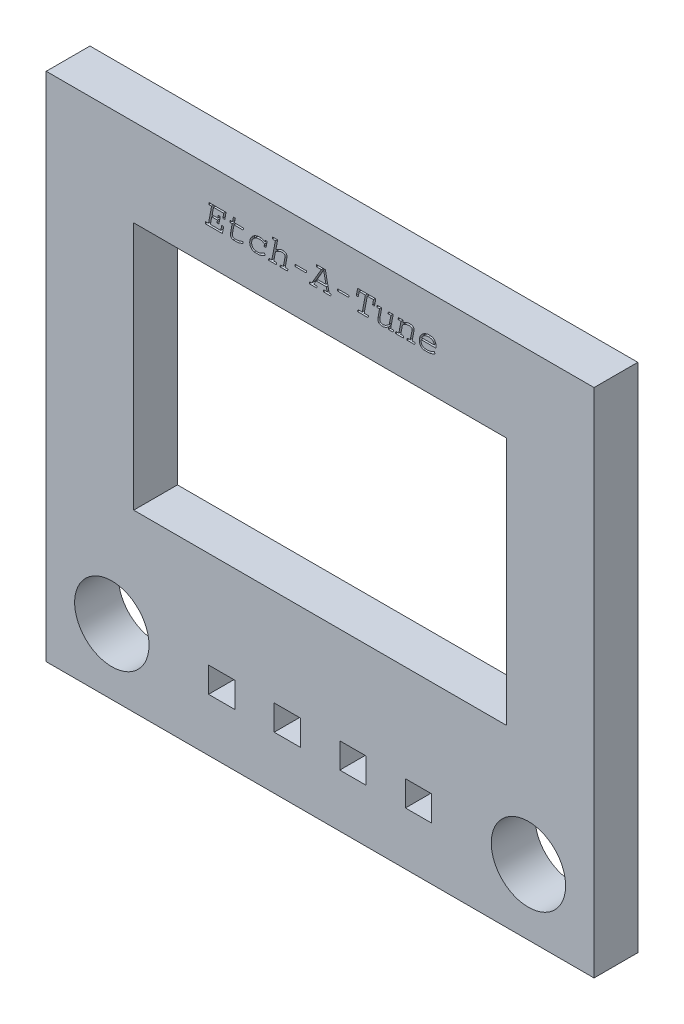
from build123d import *

# Parameters (mm, degrees)
SKETCH1_W               = 125.22
SKETCH1_H               = 116.88
SKETCH1_R               = 8.5
SKETCH1_W_2             = 6
SKETCH1_H_2             = 5.8
SKETCH1_W_3             = 85.22
SKETCH1_H_3             = 56.88
BOSS_EXTRUDE1_DEPTH     = 10
CUT_EXTRUDE2_DEPTH      = 94.295475239
CUT_EXTRUDE2_DEPTH_BACK = 1


with BuildPart() as part:
    # Sketch1 → Boss-Extrude1 (new body)
    with BuildSketch(Plane.XY):
        with Locations((0, -10)):
            Rectangle(SKETCH1_W, SKETCH1_H)
        with Locations((-47.61, -53.44)):
            Circle(SKETCH1_R, mode=Mode.SUBTRACT)
        with Locations((47.61, -53.44)):
            Circle(SKETCH1_R, mode=Mode.SUBTRACT)
        with Locations((-7.5, -53.44)):
            Rectangle(SKETCH1_W_2, SKETCH1_H_2, mode=Mode.SUBTRACT)
        Rectangle(SKETCH1_W_3, SKETCH1_H_3, mode=Mode.SUBTRACT)
        with Locations((-22.5, -53.44)):
            Rectangle(SKETCH1_W_2, SKETCH1_H_2, mode=Mode.SUBTRACT)
        with Locations((7.5, -53.44)):
            Rectangle(SKETCH1_W_2, SKETCH1_H_2, mode=Mode.SUBTRACT)
        with Locations((22.5, -53.44)):
            Rectangle(SKETCH1_W_2, SKETCH1_H_2, mode=Mode.SUBTRACT)
    extrude(amount=BOSS_EXTRUDE1_DEPTH)

    # Sketch3 → Cut-Extrude2 (cut, two sides: drawn at the far end of the back side and taken through both)
    # profile 1 of 12: a face of its own
    with BuildSketch(Plane.XY.offset(10).offset(-CUT_EXTRUDE2_DEPTH_BACK)):
        with BuildLine():
            add(Edge.make_bspline(
                [(-20.482208616, 37.419399751), (-20.497273035, 37.319431814), (-20.504494032, 37.174374239), (-20.484995783, 36.990940881), (-20.454430226, 36.874403035), (-20.409463919, 36.771380531), (-20.347318785, 36.683570606), (-20.271291293, 36.608654394), (-20.149617729, 36.534722886), (-20.027034943, 36.481544268), (-19.935351663, 36.448428045), (-19.910249606, 36.44)],
                knots=[0, 0, 0, 0, 0.171925022, 0.245944784, 0.313097413, 0.376243786, 0.436146033, 0.495162976, 0.556526645, 0.677172165, 0.722203897, 0.722203897, 0.722203897, 0.722203897], degree=3))
            Line((-19.910249606, 36.44), (-18.803897084, 36.44))
            add(Edge.make_bspline(
                [(-18.803897084, 36.44), (-18.783909316, 36.444085664), (-18.68653034, 36.464960845), (-18.288731162, 36.571282582), (-17.919603408, 36.702322853), (-17.629177284, 36.815908555)],
                knots=[0.337511133, 0.337511133, 0.337511133, 0.337511133, 0.370352222, 0.497835334, 1, 1, 1, 1], degree=3))
            Line((-17.629177284, 36.815908555), (-17.628643738, 36.816936886))
            Line((-17.628643738, 36.816936886), (-17.596366458, 37.250710149))
            add(Edge.make_bspline(
                [(-17.596366458, 37.250710149), (-17.720004103, 37.202498545), (-17.91275563, 37.133211815), (-18.178413089, 37.040950942), (-18.391613457, 36.967098556), (-18.610218931, 36.901582527), (-18.898213658, 36.836422924), (-19.115509554, 36.812385655), (-19.258892633, 36.808904048)],
                knots=[0, 0, 0, 0, 0.23027056, 0.355424111, 0.488041894, 0.621808423, 0.751237929, 1, 1, 1, 1], degree=3))
            add(Edge.make_bspline(
                [(-19.258892633, 36.808904048), (-19.364749876, 36.806227976), (-19.579403341, 36.822022979), (-19.779123271, 36.902461941), (-19.872954434, 36.952496446)],
                knots=[0, 0, 0, 0, 0.499017634, 1, 1, 1, 1], degree=3))
            add(Edge.make_bspline(
                [(-19.872954434, 36.952496446), (-19.921350257, 36.98250242), (-19.983118642, 37.044006743), (-20.034170389, 37.147849324), (-20.076913868, 37.328371885), (-20.065145785, 37.488377279), (-20.042230025, 37.612087543)],
                knots=[0, 0, 0, 0, 0.235221558, 0.352052531, 0.475253622, 1, 1, 1, 1], degree=3))
            Line((-20.042230025, 37.612087543), (-19.670181702, 39.507973027))
            Line((-19.670181702, 39.507973027), (-17.588297138, 39.507973027))
            Line((-17.588297138, 39.507973027), (-17.507603937, 39.946922147))
            Line((-17.507603937, 39.946922147), (-19.589488502, 39.946922147))
            Line((-19.589488502, 39.946922147), (-19.387755501, 40.987864429))
            Line((-19.387755501, 40.987864429), (-19.823498782, 40.987864429))
            Line((-19.823498782, 40.987864429), (-20.025231783, 39.946922147))
            Line((-20.025231783, 39.946922147), (-20.561013883, 39.946922147))
            Line((-20.561013883, 39.946922147), (-20.641707083, 39.507973027))
            Line((-20.641707083, 39.507973027), (-20.102768166, 39.507973027))
            Line((-20.102768166, 39.507973027), (-20.482208616, 37.419399751))
        make_face()
    # profile 2 of 12: a face of its own
    with BuildSketch(Plane.XY.offset(10).offset(-CUT_EXTRUDE2_DEPTH_BACK)):
        with BuildLine():
            add(Edge.make_bspline(
                [(-16.059000246, 38.245995448), (-16.08015707, 38.107140519), (-16.102850085, 37.902942111), (-16.087941017, 37.638369219), (-16.060585635, 37.45857299), (-16.014452958, 37.290771138), (-15.947855906, 37.136283744), (-15.865163169, 36.993047418), (-15.761476061, 36.865373205), (-15.644311073, 36.750761535), (-15.516129737, 36.650052175), (-15.376571625, 36.565657085), (-15.22797446, 36.494689453), (-15.117297003, 36.458038592), (-15.057820656, 36.441530507), (-15.052205643, 36.44)],
                knots=[0, 0, 0, 0, 0.149284047, 0.216678658, 0.280614799, 0.341916287, 0.400731881, 0.458649563, 0.516805113, 0.574607918, 0.632251282, 0.689318168, 0.747304962, 0.806575194, 0.812745749, 0.812745749, 0.812745749, 0.812745749], degree=3))
            Line((-15.052205643, 36.44), (-13.874437976, 36.44))
            add(Edge.make_bspline(
                [(-13.874437976, 36.44), (-13.827584008, 36.45014216), (-13.698508279, 36.481461605), (-13.491643304, 36.546276343), (-13.258131208, 36.640227069), (-12.958624307, 36.784351777), (-12.744158728, 36.910551774), (-12.608113017, 37.00503025)],
                knots=[0.320757593, 0.320757593, 0.320757593, 0.320757593, 0.390771073, 0.514663053, 0.637126272, 0.758166563, 1, 1, 1, 1], degree=3))
            Line((-12.608113017, 37.00503025), (-12.607205532, 37.006098483))
            Line((-12.607205532, 37.006098483), (-12.695968052, 37.443452664))
            add(Edge.make_bspline(
                [(-12.695968052, 37.443452664), (-12.779597468, 37.379377425), (-12.927028104, 37.287201756), (-13.14703679, 37.16211058), (-13.352371483, 37.054772738), (-13.576796432, 36.952868786), (-13.895328244, 36.8516346), (-14.143556607, 36.814069916), (-14.310208274, 36.806569212)],
                knots=[0, 0, 0, 0, 0.17937575, 0.296149719, 0.431466096, 0.574347387, 0.715767065, 1, 1, 1, 1], degree=3))
            add(Edge.make_bspline(
                [(-14.310208274, 36.806569212), (-14.450203925, 36.812592541), (-14.651547996, 36.831498148), (-14.901206911, 36.893214846), (-15.059593134, 36.949878354), (-15.197316713, 37.021017945), (-15.315127398, 37.105486498), (-15.411936063, 37.204744426), (-15.484352931, 37.318065333), (-15.539896627, 37.436042866), (-15.58694697, 37.552561333), (-15.623851027, 37.667459897), (-15.64865991, 37.781210242), (-15.661394761, 37.893870493), (-15.664596338, 38.04168789), (-15.65160828, 38.151576513), (-15.634060141, 38.22264709)],
                knots=[0, 0, 0, 0, 0.185136859, 0.265600362, 0.338874002, 0.406636634, 0.469503129, 0.529431379, 0.588401354, 0.646052855, 0.70136492, 0.754151755, 0.805121093, 0.854745412, 0.903544387, 1, 1, 1, 1], degree=3))
            add(Edge.make_bspline(
                [(-15.634060141, 38.22264709), (-15.615201596, 38.312982006), (-15.576152133, 38.446135913), (-15.49916954, 38.613892193), (-15.429889349, 38.734282143), (-15.350122769, 38.850107562), (-15.259966224, 38.962111611), (-15.156598797, 39.067633846), (-15.044199257, 39.169135844), (-14.922280892, 39.262103032), (-14.792553016, 39.344495923), (-14.654723028, 39.412997763), (-14.511166618, 39.4722072), (-14.359655488, 39.517308536), (-14.145479443, 39.563269851), (-13.97919635, 39.578485348), (-13.866589483, 39.581521493)],
                knots=[0, 0, 0, 0, 0.115015297, 0.172080703, 0.229638415, 0.287876346, 0.347172525, 0.408555374, 0.471737072, 0.535745095, 0.599377335, 0.662915281, 0.727296895, 0.792644528, 0.859598727, 1, 1, 1, 1], degree=3))
            add(Edge.make_bspline(
                [(-13.866589483, 39.581521493), (-13.754221209, 39.58495564), (-13.58853153, 39.575534414), (-13.37482953, 39.536714476), (-13.226046458, 39.493036646), (-13.084852934, 39.437236496), (-12.907808311, 39.342702435), (-12.78687426, 39.252637431), (-12.713180625, 39.184599417)],
                knots=[0, 0, 0, 0, 0.269310277, 0.396464342, 0.519857169, 0.640417922, 0.759763624, 1, 1, 1, 1], degree=3))
            Line((-12.713180625, 39.184599417), (-12.817007852, 38.636236793))
            Line((-12.817007852, 38.636236793), (-12.373195251, 38.636236793))
            Line((-12.373195251, 38.636236793), (-12.098838371, 40.021636891))
            Line((-12.098838371, 40.021636891), (-12.542650972, 40.021636891))
            Line((-12.542650972, 40.021636891), (-12.615274852, 39.64539088))
            add(Edge.make_bspline(
                [(-12.615274852, 39.64539088), (-12.694124049, 39.704856369), (-12.818080358, 39.787810372), (-12.997472061, 39.873035079), (-13.138690482, 39.926356696), (-13.287059979, 39.966359728), (-13.496867772, 40.008240182), (-13.65961146, 40.019556006), (-13.769693799, 40.020470613)],
                knots=[0, 0, 0, 0, 0.239879832, 0.360255007, 0.48127662, 0.605673659, 0.732716306, 1, 1, 1, 1], degree=3))
            add(Edge.make_bspline(
                [(-13.769693799, 40.020470613), (-13.934782687, 40.013706007), (-14.17687666, 39.989776205), (-14.484944191, 39.918539822), (-14.695488411, 39.84925883), (-14.891180959, 39.764737411), (-15.071237169, 39.661540199), (-15.238427464, 39.544634713), (-15.386059719, 39.407844252), (-15.519899662, 39.265342594), (-15.640997051, 39.121293324), (-15.747483705, 38.976869288), (-15.838866545, 38.831544881), (-15.916651908, 38.686251863), (-15.999935326, 38.494611767), (-16.041883388, 38.345659219), (-16.059000246, 38.245995448)],
                knots=[0, 0, 0, 0, 0.158335924, 0.232205823, 0.302458624, 0.370394891, 0.436000599, 0.500953953, 0.565343349, 0.628364167, 0.688164326, 0.74549602, 0.800100691, 0.852460794, 0.903216108, 1, 1, 1, 1], degree=3))
        make_face()
    # profile 3 of 12: a face of its own
    with BuildSketch(Plane.XY.offset(10).offset(-CUT_EXTRUDE2_DEPTH_BACK)):
        with BuildLine():
            Line((23.703723188, 36.44), (24.964770159, 36.44))
            add(Edge.make_bspline(
                [(24.964770159, 36.44), (24.987926485, 36.444452529), (25.095518979, 36.466178763), (25.285897379, 36.513556244), (25.531913461, 36.589871886), (25.850708678, 36.701826957), (26.081006708, 36.803855801), (26.229544747, 36.87894912)],
                knots=[0.336902526, 0.336902526, 0.336902526, 0.336902526, 0.371837561, 0.499516502, 0.627371085, 0.75338703, 1, 1, 1, 1], degree=3))
            Line((26.229544747, 36.87894912), (26.229954027, 36.879935269))
            Line((26.229954027, 36.879935269), (26.173468787, 37.307669653))
            add(Edge.make_bspline(
                [(26.173468787, 37.307669653), (26.006773567, 37.224313745), (25.759296002, 37.110289417), (25.426908014, 36.991633308), (25.195826411, 36.922386957), (24.978946988, 36.87254899), (24.730238298, 36.823147141), (24.551669218, 36.80757936), (24.439893149, 36.806569212)],
                knots=[0, 0, 0, 0, 0.307566299, 0.448678463, 0.581915956, 0.705232438, 0.815643938, 1, 1, 1, 1], degree=3))
            add(Edge.make_bspline(
                [(24.439893149, 36.806569212), (24.258804454, 36.807793771), (24.032852833, 36.821445353), (23.773928483, 36.884232664), (23.617855742, 36.942923258), (23.50842515, 37.001303709), (23.441750868, 37.049392129)],
                knots=[0, 0, 0, 0, 0.521686336, 0.645104503, 0.764352816, 1, 1, 1, 1], degree=3))
            add(Edge.make_bspline(
                [(23.441750868, 37.049392129), (23.372997104, 37.098047261), (23.28808178, 37.196182485), (23.200061961, 37.349634496), (23.149008507, 37.483763908), (23.111329883, 37.628522227), (23.086881467, 37.834973851), (23.095039936, 37.992829519), (23.111371611, 38.097733378)],
                knots=[0, 0, 0, 0, 0.217640528, 0.334392378, 0.459650859, 0.590528753, 0.723384468, 1, 1, 1, 1], degree=3))
            Line((23.111371611, 38.097733378), (23.127601455, 38.163107639))
            Line((23.127601455, 38.163107639), (26.431687027, 38.163107639))
            add(Edge.make_bspline(
                [(26.431687027, 38.163107639), (26.456413892, 38.284260522), (26.481226859, 38.464940193), (26.483121048, 38.702330497), (26.469739468, 38.869812812), (26.438734381, 39.029483905), (26.395351609, 39.18274672), (26.332809879, 39.32699013), (26.259617843, 39.465323575), (26.167455706, 39.592810573), (26.05354993, 39.703706532), (25.919841025, 39.797885707), (25.76602395, 39.874720743), (25.593231924, 39.936604704), (25.325531595, 39.998921481), (25.111781053, 40.016207733), (24.964063773, 40.020470613)],
                knots=[0, 0, 0, 0, 0.131929456, 0.193772399, 0.252918713, 0.310794655, 0.36700822, 0.422433297, 0.478148215, 0.533685068, 0.589449434, 0.646913166, 0.707424242, 0.772280091, 0.842245474, 1, 1, 1, 1], degree=3))
            add(Edge.make_bspline(
                [(24.964063773, 40.020470613), (24.830127216, 40.017642061), (24.631023897, 40.002559422), (24.373550115, 39.948132011), (24.187957166, 39.895092574), (24.009536126, 39.824318216), (23.836684562, 39.740138491), (23.670870677, 39.640141603), (23.511347452, 39.527844185), (23.362411499, 39.402191656), (23.225940136, 39.265098701), (23.104696528, 39.116698068), (22.997313611, 38.957806178), (22.905515294, 38.788177667), (22.798859347, 38.545146271), (22.743466452, 38.351164077), (22.71678437, 38.217977419)],
                knots=[0, 0, 0, 0, 0.128681092, 0.190871087, 0.252333425, 0.313715137, 0.374850912, 0.436662917, 0.499358916, 0.561910123, 0.623446181, 0.684755125, 0.745562583, 0.807235637, 0.869619359, 1, 1, 1, 1], degree=3))
            add(Edge.make_bspline(
                [(22.71678437, 38.217977419), (22.692059545, 38.10044191), (22.6696667, 37.924589381), (22.670990795, 37.693030983), (22.686838571, 37.528682717), (22.719738871, 37.370679729), (22.767957448, 37.218938111), (22.831088427, 37.073458306), (22.910254478, 36.934940768), (23.007926752, 36.806825701), (23.127870458, 36.693984712), (23.27020617, 36.599624303), (23.432375611, 36.519605083), (23.580360472, 36.470687748), (23.673054638, 36.447123351), (23.703723188, 36.44)],
                knots=[0, 0, 0, 0, 0.125286762, 0.184149964, 0.241265503, 0.297234199, 0.352182212, 0.407085221, 0.462371085, 0.518233685, 0.574520933, 0.63329308, 0.695745078, 0.762627266, 0.795462314, 0.795462314, 0.795462314, 0.795462314], degree=3))
        make_face()
        with BuildLine():
            add(Edge.make_bspline(
                [(24.875340015, 39.581521493), (24.998048906, 39.576894608), (25.173065078, 39.556331331), (25.391564968, 39.507453716), (25.528576317, 39.460508347), (25.647614726, 39.404345909), (25.747396907, 39.335464668), (25.830244413, 39.257460497), (25.889654204, 39.16698027), (25.9353001, 39.076794683), (25.976218542, 38.99238937), (26.007590565, 38.913138806), (26.03158294, 38.839519874), (26.046410258, 38.771810605), (26.058660535, 38.693307905), (26.053239856, 38.636539852), (26.043925305, 38.602057899)],
                knots=[0, 0, 0, 0, 0.211912772, 0.303701498, 0.386173157, 0.461624967, 0.530234393, 0.594877287, 0.656771187, 0.715998313, 0.769515657, 0.81869113, 0.863117512, 0.903067969, 0.938333711, 1, 1, 1, 1], degree=3))
            Line((26.043925305, 38.602057899), (23.232354408, 38.602057899))
            add(Edge.make_bspline(
                [(23.232354408, 38.602057899), (23.250326071, 38.66445498), (23.292503039, 38.753356352), (23.361826332, 38.867094617), (23.42528178, 38.950317432), (23.496587463, 39.033069548), (23.57917212, 39.112025611), (23.67012191, 39.190260972), (23.769953483, 39.266279068), (23.879226728, 39.335839904), (23.996913207, 39.398359759), (24.123029524, 39.451948175), (24.257789581, 39.496235771), (24.400656594, 39.531230321), (24.606749539, 39.565624409), (24.766406973, 39.578257099), (24.875340015, 39.581521493)],
                knots=[0, 0, 0, 0, 0.095332743, 0.144541112, 0.196185087, 0.249464077, 0.305463924, 0.36446722, 0.426325652, 0.490316448, 0.55525981, 0.622619761, 0.692118577, 0.764210348, 0.839302135, 1, 1, 1, 1], degree=3))
        make_face(mode=Mode.SUBTRACT)
    # profile 4 of 12: a face of its own
    with BuildSketch(Plane.XY.offset(10).offset(-CUT_EXTRUDE2_DEPTH_BACK)):
        with BuildLine():
            add(Edge.make_bspline(
                [(13.410129095, 36.63729362), (13.458240866, 36.588416531), (13.542810978, 36.528386544), (13.659064832, 36.469346829), (13.717273098, 36.448245547), (13.74302901, 36.44)],
                knots=[0, 0, 0, 0, 0.232386943, 0.350881934, 0.442866453, 0.442866453, 0.442866453, 0.442866453], degree=3))
            Line((13.74302901, 36.44), (14.713685987, 36.44))
            add(Edge.make_bspline(
                [(14.713685987, 36.44), (14.745171679, 36.449038026), (14.806915849, 36.468298454), (14.901153678, 36.501888843), (14.997276392, 36.545318731), (15.099273401, 36.598755122), (15.207864232, 36.659912886), (15.320949434, 36.733580044), (15.48751756, 36.845799886), (15.611110904, 36.941290218), (15.695933288, 37.007365086)],
                knots=[0.301705281, 0.301705281, 0.301705281, 0.301705281, 0.361790786, 0.420289256, 0.485171166, 0.555104792, 0.631530698, 0.713725298, 0.802640923, 1, 1, 1, 1], degree=3))
            Line((15.695933288, 37.007365086), (15.591615837, 36.444669671))
            Line((15.591615837, 36.444669671), (16.689043359, 36.444669671))
            Line((16.689043359, 36.444669671), (16.777805879, 36.883618791))
            Line((16.777805879, 36.883618791), (16.116121638, 36.883618791))
            Line((16.116121638, 36.883618791), (16.705181999, 39.946922147))
            Line((16.705181999, 39.946922147), (15.599685157, 39.946922147))
            Line((15.599685157, 39.946922147), (15.518991957, 39.507973027))
            Line((15.518991957, 39.507973027), (16.188745518, 39.507973027))
            Line((16.188745518, 39.507973027), (15.801418157, 37.560566109))
            add(Edge.make_bspline(
                [(15.801418157, 37.560566109), (15.704199716, 37.456848351), (15.545750321, 37.315242642), (15.320354896, 37.145894241), (15.146617302, 37.031275683), (14.967146725, 36.934065911), (14.719686505, 36.842472658), (14.526195436, 36.808397413), (14.396597197, 36.806569212)],
                knots=[0, 0, 0, 0, 0.260632244, 0.389185175, 0.517149541, 0.642384326, 0.76283589, 1, 1, 1, 1], degree=3))
            add(Edge.make_bspline(
                [(14.396597197, 36.806569212), (14.28853953, 36.806246478), (14.080333832, 36.828912813), (13.88662861, 36.912016864), (13.808218589, 36.974677385)],
                knots=[0, 0, 0, 0, 0.520920097, 1, 1, 1, 1], degree=3))
            add(Edge.make_bspline(
                [(13.808218589, 36.974677385), (13.760935519, 37.017659569), (13.703770405, 37.095266729), (13.65520064, 37.214100441), (13.638131223, 37.310612005), (13.631814877, 37.411174488), (13.633409348, 37.551755113), (13.64692436, 37.65816613), (13.662291355, 37.728829331)],
                knots=[0, 0, 0, 0, 0.237352853, 0.354638007, 0.475943508, 0.601115059, 0.7303471, 1, 1, 1, 1], degree=3))
            Line((13.662291355, 37.728829331), (14.090722314, 39.946922147))
            Line((14.090722314, 39.946922147), (13.030434412, 39.946922147))
            Line((13.030434412, 39.946922147), (12.949741212, 39.507973027))
            Line((12.949741212, 39.507973027), (13.579555174, 39.507973027))
            Line((13.579555174, 39.507973027), (13.221083783, 37.512485366))
            add(Edge.make_bspline(
                [(13.221083783, 37.512485366), (13.205634608, 37.43178774), (13.191770107, 37.310267662), (13.194424364, 37.149382703), (13.208264864, 37.033457835), (13.234240391, 36.922292586), (13.290805053, 36.782592832), (13.359315282, 36.692037616), (13.410129095, 36.63729362)],
                knots=[0, 0, 0, 0, 0.264501774, 0.392315798, 0.517254577, 0.639712667, 0.75883113, 1, 1, 1, 1], degree=3))
        make_face()
    # profile 5 of 12: a face of its own
    with BuildSketch(Plane.XY.offset(10).offset(-CUT_EXTRUDE2_DEPTH_BACK)):
        with BuildLine():
            Line((14.713685987, 36.44), (13.74302901, 36.44))
            add(Edge.make_bspline(
                [(13.74302901, 36.44), (13.751883096, 36.437165436), (13.796463174, 36.423532128), (13.878551491, 36.403416557), (14.031014175, 36.378495772), (14.14806351, 36.370391097), (14.227321605, 36.371122346)],
                knots=[0.442866453, 0.442866453, 0.442866453, 0.442866453, 0.474487887, 0.601407584, 0.730344075, 1, 1, 1, 1], degree=3))
            add(Edge.make_bspline(
                [(14.227321605, 36.371122346), (14.314706679, 36.364088963), (14.453234629, 36.379776583), (14.614370732, 36.412929143), (14.68905125, 36.432928553), (14.713685987, 36.44)],
                knots=[0, 0, 0, 0, 0.159895565, 0.254693751, 0.301705281, 0.301705281, 0.301705281, 0.301705281], degree=3))
        make_face()
    # profile 6 of 12: a face of its own
    with BuildSketch(Plane.XY.offset(10).offset(-CUT_EXTRUDE2_DEPTH_BACK)):
        Polygon((-26.250559408, 36.444669671), (-22.342064894, 36.444669671), (-22.042656412, 37.991124413), (-22.487723075, 37.991124413), (-22.698118225, 36.883618791), (-25.085293963, 36.883618791), (-24.769701238, 38.536681358), (-23.474961855, 38.536681358), (-23.588251551, 37.942263871), (-23.143184888, 37.942263871), (-22.827592163, 39.575292225), (-23.272658826, 39.575292225), (-23.385948522, 38.975631618), (-24.680687906, 38.975631618), (-24.365095181, 40.628693044), (-22.026472169, 40.628693044), (-22.236867319, 39.526671094), (-21.791800656, 39.526671094), (-21.492164162, 41.067643304), (-25.368518203, 41.067643304), (-25.457531536, 40.628693044), (-24.802069723, 40.628693044), (-25.522268505, 36.883618791), (-26.161546076, 36.883618791), align=None)
    # profile 7 of 12: a face of its own
    with BuildSketch(Plane.XY.offset(10).offset(-CUT_EXTRUDE2_DEPTH_BACK)):
        with BuildLine():
            Line((-9.17301101, 36.444669671), (-7.442969547, 36.444669671))
            Line((-7.442969547, 36.444669671), (-7.354207027, 36.883618791))
            Line((-7.354207027, 36.883618791), (-7.989329092, 36.883618791))
            Line((-7.989329092, 36.883618791), (-7.618512029, 38.917878635))
            add(Edge.make_bspline(
                [(-7.618512029, 38.917878635), (-7.58847412, 39.043363358), (-7.570843113, 39.235734273), (-7.608863984, 39.485594345), (-7.657099449, 39.632476146), (-7.716192371, 39.741030978), (-7.778559899, 39.812775519), (-7.857840819, 39.872011313), (-7.950619207, 39.924496607), (-8.061160922, 39.962887619), (-8.237459609, 40.005667264), (-8.380641329, 40.016060787), (-8.480123422, 40.020470613)],
                knots=[0, 0, 0, 0, 0.229490145, 0.338713725, 0.447695898, 0.502543934, 0.557487927, 0.6152075, 0.677783689, 0.746306617, 0.822506268, 1, 1, 1, 1], degree=3))
            add(Edge.make_bspline(
                [(-8.480123422, 40.020470613), (-8.623254832, 40.016789662), (-8.839606855, 39.992314647), (-9.120940101, 39.912224196), (-9.33085375, 39.829769073), (-9.537152673, 39.732220641), (-9.804721856, 39.584402126), (-9.996486774, 39.458692316), (-10.118010696, 39.365549187)],
                knots=[0, 0, 0, 0, 0.239738856, 0.362217899, 0.488615636, 0.616811255, 0.743905164, 1, 1, 1, 1], degree=3))
            Line((-10.118010696, 39.365549187), (-9.705586131, 41.515931767))
            Line((-9.705586131, 41.515931767), (-10.827221614, 41.515931767))
            Line((-10.827221614, 41.515931767), (-10.915984134, 41.076981507))
            Line((-10.915984134, 41.076981507), (-10.230091932, 41.076981507))
            Line((-10.230091932, 41.076981507), (-11.037023934, 36.883618791))
            Line((-11.037023934, 36.883618791), (-11.706777495, 36.883618791))
            Line((-11.706777495, 36.883618791), (-11.795540016, 36.444669671))
            Line((-11.795540016, 36.444669671), (-10.020289612, 36.444669671))
            Line((-10.020289612, 36.444669671), (-9.931527092, 36.883618791))
            Line((-9.931527092, 36.883618791), (-10.601280653, 36.883618791))
            Line((-10.601280653, 36.883618791), (-10.213953292, 38.885843047))
            add(Edge.make_bspline(
                [(-10.213953292, 38.885843047), (-10.099913309, 38.976702702), (-9.920024485, 39.102583118), (-9.669651607, 39.256132566), (-9.477610567, 39.365187454), (-9.280340023, 39.456485136), (-9.018322073, 39.547334498), (-8.814939602, 39.577725846), (-8.680919296, 39.581521493)],
                knots=[0, 0, 0, 0, 0.255521599, 0.384464681, 0.514872175, 0.642476354, 0.765019569, 1, 1, 1, 1], degree=3))
            add(Edge.make_bspline(
                [(-8.680919296, 39.581521493), (-8.608222728, 39.580571106), (-8.504532544, 39.572397146), (-8.376059167, 39.542942181), (-8.296293598, 39.515323678), (-8.227102119, 39.480586305), (-8.170264329, 39.436842226), (-8.124535413, 39.385986495), (-8.08108704, 39.307296398), (-8.047709381, 39.197201737), (-8.01987621, 38.999775188), (-8.037058726, 38.844718362), (-8.059852988, 38.740980626)],
                knots=[0, 0, 0, 0, 0.171740382, 0.244386101, 0.310633295, 0.370622681, 0.426299739, 0.479018073, 0.530864703, 0.637194109, 0.748536855, 1, 1, 1, 1], degree=3))
            Line((-8.059852988, 38.740980626), (-8.422564248, 36.883618791))
            Line((-8.422564248, 36.883618791), (-9.08424849, 36.883618791))
            Line((-9.08424849, 36.883618791), (-9.17301101, 36.444669671))
        make_face()
    # profile 8 of 12: a face of its own
    with BuildSketch(Plane.XY.offset(10).offset(-CUT_EXTRUDE2_DEPTH_BACK)):
        Polygon((-5.781000859, 38.237822383), (-3.198818454, 38.237822383), (-3.110055934, 38.676772643), (-5.692238339, 38.676772643), align=None)
    # profile 9 of 12: a face of its own
    with BuildSketch(Plane.XY.offset(10).offset(-CUT_EXTRUDE2_DEPTH_BACK)):
        Polygon((0.725349557, 36.444669671), (2.409692995, 36.444669671), (2.498273106, 36.883618791), (2.063153436, 36.883618791), (1.192775009, 41.067643304), (-0.781694571, 41.067643304), (-0.870344225, 40.628693044), (0.282101284, 40.628693044), (-1.909962902, 36.883618791), (-2.409624591, 36.883618791), (-2.498274246, 36.444669671), (-0.78975363, 36.444669671), (-0.701103976, 36.883618791), (-1.434478391, 36.883618791), (-0.910639523, 37.78953392), (1.418428675, 37.78953392), (1.603787044, 36.883618791), (0.813999212, 36.883618791), align=None)
        Polygon((0.797881093, 40.778122532), (1.329779021, 38.22848418), (-0.644690559, 38.22848418), align=None, mode=Mode.SUBTRACT)
    # profile 10 of 12: a face of its own
    with BuildSketch(Plane.XY.offset(10).offset(-CUT_EXTRUDE2_DEPTH_BACK)):
        Polygon((3.931915835, 38.237822383), (6.514098241, 38.237822383), (6.602860761, 38.676772643), (4.020678355, 38.676772643), align=None)
    # profile 11 of 12: a face of its own
    with BuildSketch(Plane.XY.offset(10).offset(-CUT_EXTRUDE2_DEPTH_BACK)):
        Polygon((11.974105928, 39.445052168), (12.417918528, 39.445052168), (12.732622009, 41.067643304), (8.5769222, 41.067643304), (8.26221872, 39.445052168), (8.706031321, 39.445052168), (8.931972281, 40.628693044), (10.344103284, 40.628693044), (9.625933803, 36.883618791), (8.63340744, 36.883618791), (8.54464492, 36.444669671), (10.973510245, 36.444669671), (11.062272766, 36.883618791), (10.069746403, 36.883618791), (10.787915885, 40.628693044), (12.200046888, 40.628693044), align=None)
    # profile 12 of 12: a face of its own
    with BuildSketch(Plane.XY.offset(10).offset(-CUT_EXTRUDE2_DEPTH_BACK)):
        with BuildLine():
            Line((19.850516982, 36.444669671), (21.609628745, 36.444669671))
            Line((21.609628745, 36.444669671), (21.698391266, 36.883618791))
            Line((21.698391266, 36.883618791), (21.036707024, 36.883618791))
            Line((21.036707024, 36.883618791), (21.432103705, 38.963665585))
            add(Edge.make_bspline(
                [(21.432103705, 38.963665585), (21.44827238, 39.03324156), (21.468949028, 39.140070174), (21.472223375, 39.285828306), (21.468246127, 39.39672063), (21.454092848, 39.505994599), (21.407693794, 39.641065007), (21.350072823, 39.730495511), (21.301873909, 39.781149949)],
                knots=[0, 0, 0, 0, 0.248919025, 0.376207295, 0.506250411, 0.6348772, 0.757712729, 1, 1, 1, 1], degree=3))
            add(Edge.make_bspline(
                [(21.301873909, 39.781149949), (21.264565658, 39.818037546), (21.198317663, 39.866201018), (21.098509095, 39.918615458), (21.011451576, 39.955518258), (20.912805627, 39.984407596), (20.756552671, 40.013759597), (20.631533589, 40.019723586), (20.54421971, 40.020470613)],
                knots=[0, 0, 0, 0, 0.192799008, 0.299924339, 0.414972033, 0.54064592, 0.677886928, 1, 1, 1, 1], degree=3))
            add(Edge.make_bspline(
                [(20.54421971, 40.020470613), (20.402960008, 40.018490702), (20.189041394, 39.998440663), (19.909155409, 39.929733401), (19.699311511, 39.858308752), (19.493524935, 39.769132602), (19.223925545, 39.632069475), (19.034025061, 39.505890417), (18.913336943, 39.41341332)],
                knots=[0, 0, 0, 0, 0.239529587, 0.362394002, 0.487754306, 0.614810655, 0.742248234, 1, 1, 1, 1], degree=3))
            Line((18.913336943, 39.41341332), (19.0113077, 39.946922147))
            Line((19.0113077, 39.946922147), (17.905810858, 39.946922147))
            Line((17.905810858, 39.946922147), (17.817048337, 39.507973027))
            Line((17.817048337, 39.507973027), (18.486801899, 39.507973027))
            Line((18.486801899, 39.507973027), (17.986504058, 36.883618791))
            Line((17.986504058, 36.883618791), (17.316750496, 36.883618791))
            Line((17.316750496, 36.883618791), (17.227987976, 36.444669671))
            Line((17.227987976, 36.444669671), (19.00323838, 36.444669671))
            Line((19.00323838, 36.444669671), (19.0920009, 36.883618791))
            Line((19.0920009, 36.883618791), (18.422247339, 36.883618791))
            Line((18.422247339, 36.883618791), (18.817644019, 38.925887532))
            add(Edge.make_bspline(
                [(18.817644019, 38.925887532), (18.924063681, 39.020263443), (19.095755924, 39.150126924), (19.343752337, 39.297147887), (19.539307085, 39.394704014), (19.738623577, 39.474683242), (19.998412889, 39.552487678), (20.196109662, 39.579347321), (20.325912568, 39.581521493)],
                knots=[0, 0, 0, 0, 0.254464671, 0.384045203, 0.515468857, 0.645170961, 0.767901484, 1, 1, 1, 1], degree=3))
            add(Edge.make_bspline(
                [(20.325912568, 39.581521493), (20.415491609, 39.584922741), (20.549398775, 39.573862826), (20.718269218, 39.521383347), (20.816054503, 39.474478404), (20.887257622, 39.426403666), (20.930513571, 39.378913524), (20.963868726, 39.323484145), (20.99083179, 39.260526961), (21.004662335, 39.187904098), (21.014672616, 39.0752522), (21.005522705, 38.98624777), (20.996010427, 38.925432649)],
                knots=[0, 0, 0, 0, 0.239078858, 0.354240954, 0.469757569, 0.527036488, 0.582093105, 0.639381416, 0.698908138, 0.763606145, 0.835451874, 1, 1, 1, 1], degree=3))
            Line((20.996010427, 38.925432649), (20.600963743, 36.883618791))
            Line((20.600963743, 36.883618791), (19.939279502, 36.883618791))
            Line((19.939279502, 36.883618791), (19.850516982, 36.444669671))
        make_face()
    extrude(amount=CUT_EXTRUDE2_DEPTH + CUT_EXTRUDE2_DEPTH_BACK, mode=Mode.SUBTRACT)


solid = part.part
